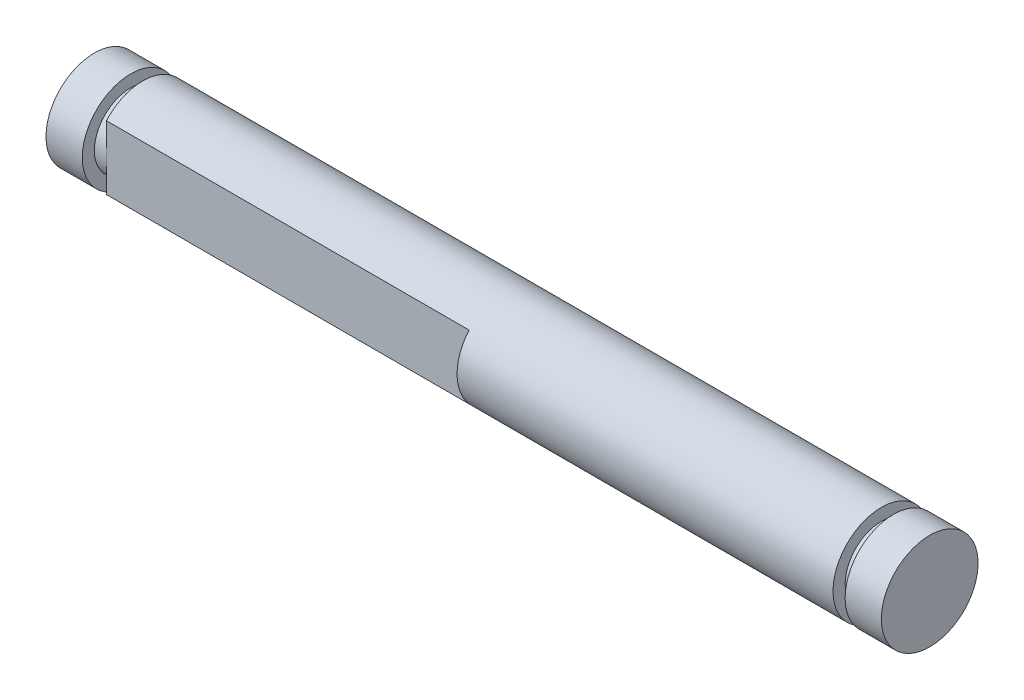
from build123d import *

# Parameters (mm, degrees)
CORTAR_EXTRUIR1_DEPTH      = 36.010034276
CORTAR_EXTRUIR1_DEPTH_BACK = 36.010034276
CROQUIS2_W                 = 30
CROQUIS2_H                 = 1


with BuildPart() as part:
    # Croquis1 → Revolución1 (revolve)
    with BuildSketch(Plane(origin=(0, 0, 0), x_dir=(1, 0, 0), z_dir=(0, 1, 0)), mode=Mode.PRIVATE) as revoluci_n1_sk:
        Polygon((-34.55, 0), (-34.55, 4), (-31.55, 4), (-31.55, 3), (-30.55, 3), (-30.55, 4), (30.55, 4), (30.55, 3), (31.55, 3), (31.55, 4), (34.55, 4), (34.55, 0), align=None)
    revolve(revoluci_n1_sk.sketch.rotate(Axis((-34.55, 0, 0), (1, 0, 0)), 180), axis=Axis((-34.55, 0, 0), (1, 0, 0)))

    # Croquis2 → Cortar-Extruir1 (cut, two sides: drawn at the far end of the back side and taken through both)
    with BuildSketch(Plane(origin=(0, 0, 0), x_dir=(1, 0, 0), z_dir=(0, 1, 0)).offset(-CORTAR_EXTRUIR1_DEPTH_BACK)):
        with Locations((-15.55, -3.5)):
            Rectangle(CROQUIS2_W, CROQUIS2_H)
    extrude(amount=CORTAR_EXTRUIR1_DEPTH + CORTAR_EXTRUIR1_DEPTH_BACK, mode=Mode.SUBTRACT)


solid = part.part
